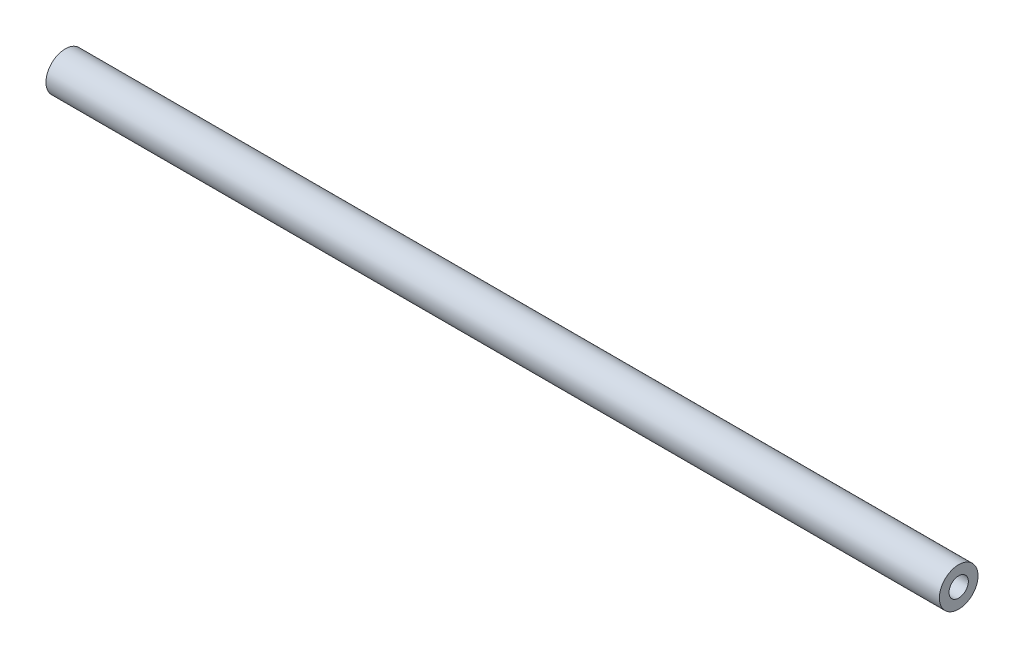
from build123d import *

# Parameters (mm, degrees)
SKETCH_1_R      = 4
SKETCH_1_R_2    = 2
EXTRUDE_1_DEPTH = 185


with BuildPart() as part:
    # 草图1 → 凸台-拉伸1 (new body)
    with BuildSketch(Plane(origin=(0, 0, 0), x_dir=(0, 0, -1), z_dir=(1, 0, 0))):
        Circle(SKETCH_1_R)
        Circle(SKETCH_1_R_2, mode=Mode.SUBTRACT)
    extrude(amount=EXTRUDE_1_DEPTH)


solid = part.part
